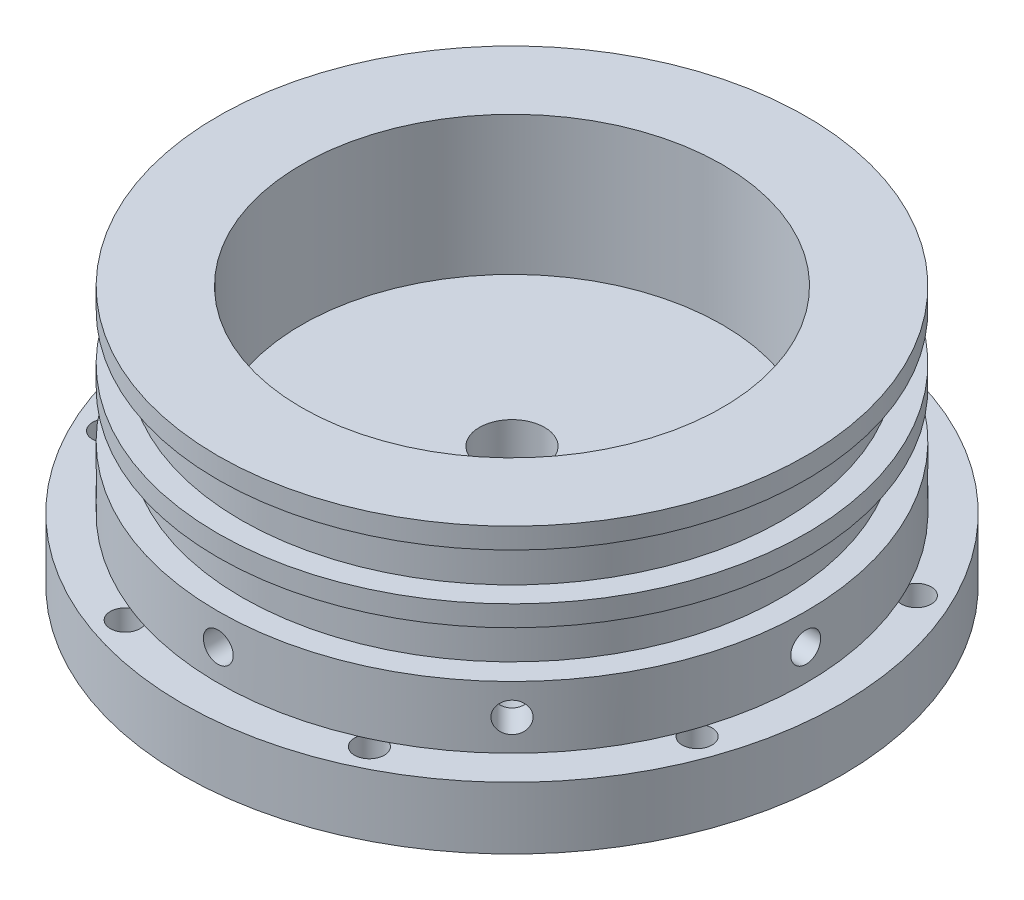
from build123d import *

# Parameters (mm, degrees)
SKETCH1_R                        = 45.085
BOSS_EXTRUDE1_DEPTH              = 9.525
SKETCH2_R                        = 41.402
BOSS_EXTRUDE2_DEPTH              = 7.1374
SKETCH3_R                        = 45.085
BOSS_EXTRUDE3_DEPTH              = 3.175
SKETCH4_R                        = 41.529
BOSS_EXTRUDE4_DEPTH              = 7.1374
SKETCH5_R                        = 45.085
BOSS_EXTRUDE5_DEPTH              = 3.175
CIRPATTERN1_COUNT                = 8
M10X1_0_TAPPED_HOLE1_D           = 9
M10X1_0_TAPPED_HOLE1_DEPTH       = 25
M10X1_0_TAPPED_HOLE1_CBORE_D     = 10
M10X1_0_TAPPED_HOLE1_CBORE_DEPTH = 20
M10X1_0_TAPPED_HOLE1_TIP         = 2.703872786
SKETCH9_R                        = 32.259
CUT_EXTRUDE1_DEPTH               = 21.2598
SKETCH11_R                       = 50.546
BOSS_EXTRUDE6_DEPTH              = 9.525
SKETCH12_R                       = 28.575
CUT_EXTRUDE2_DEPTH               = 9.525
F_15_0_18_DIAMETER_HOLE1_D       = 4.572
F_15_0_18_DIAMETER_HOLE1_DEPTH   = 9.525
CIRPATTERN2_COUNT                = 8


with BuildPart() as part:
    # Sketch1 → Boss-Extrude1 (new body)
    with BuildSketch(Plane(origin=(0, 0, 0), x_dir=(1, 0, 0), z_dir=(0, 1, 0))):
        with Locations(Location((0, 0, 0), (0, 0, 90))):
            Circle(SKETCH1_R)
    extrude(amount=BOSS_EXTRUDE1_DEPTH)

    # Sketch2 → Boss-Extrude2 (add)
    with BuildSketch(Plane(origin=(0, 9.525, 0), x_dir=(1, 0, 0), z_dir=(0, 1, 0))):
        with Locations(Location((0, 0, 0), (0, 0, 270))):
            Circle(SKETCH2_R)
    extrude(amount=BOSS_EXTRUDE2_DEPTH)

    # Sketch3 → Boss-Extrude3 (add)
    with BuildSketch(Plane(origin=(0, 16.6624, 0), x_dir=(1, 0, 0), z_dir=(0, 1, 0))):
        with Locations(Location((0, 0, 0), (0, 0, 90))):
            Circle(SKETCH3_R)
    extrude(amount=BOSS_EXTRUDE3_DEPTH)

    # Sketch4 → Boss-Extrude4 (add)
    with BuildSketch(Plane(origin=(0, 19.8374, 0), x_dir=(1, 0, 0), z_dir=(0, 1, 0))):
        with Locations(Location((0, 0, 0), (0, 0, 270))):
            Circle(SKETCH4_R)
    extrude(amount=BOSS_EXTRUDE4_DEPTH)

    # Sketch5 → Boss-Extrude5 (add)
    with BuildSketch(Plane(origin=(0, 26.9748, 0), x_dir=(1, 0, 0), z_dir=(0, 1, 0))):
        with Locations(Location((0, 0, 0), (0, 0, 90))):
            Circle(SKETCH5_R)
    extrude(amount=BOSS_EXTRUDE5_DEPTH)

    # Sketch6 → #15 (0.18) Diameter Hole2 (revolve, cut)
    with BuildSketch(Plane(origin=(-45.085, 4.7625, 0), x_dir=(0, 0, 1), z_dir=(0, 1, 0))):
        Polygon((0, 0), (0, 6.373567375), (2.286, 5), (2.286, 0), align=None)
    f_15_0_18_diameter_hole2 = revolve(axis=Axis((-51.435, 4.7625, 0), (1, 0, 0)), mode=Mode.SUBTRACT)

    # CirPattern1: #15 (0.18) Diameter Hole2 ×8 about axis
    cirpattern1_axis = Axis((0, 9.525, 0), (0, -1, 0))
    for i in range(1, CIRPATTERN1_COUNT):
        add(f_15_0_18_diameter_hole2.rotate(cirpattern1_axis, i * 360 / CIRPATTERN1_COUNT), mode=Mode.SUBTRACT)

    # M10x1.0 Tapped Hole1
    with Locations(Plane(origin=(0, 0, 0), x_dir=(-1, 0, 0), z_dir=(0, -1, 0))):
        with Locations((0, 0)):
            CounterBoreHole(M10X1_0_TAPPED_HOLE1_D / 2, M10X1_0_TAPPED_HOLE1_CBORE_D / 2, M10X1_0_TAPPED_HOLE1_CBORE_DEPTH, depth=M10X1_0_TAPPED_HOLE1_DEPTH)
            with Locations((0, 0, -(M10X1_0_TAPPED_HOLE1_DEPTH + M10X1_0_TAPPED_HOLE1_TIP / 2))):  # 118° drill point
                Cone(0, M10X1_0_TAPPED_HOLE1_D / 2, M10X1_0_TAPPED_HOLE1_TIP, mode=Mode.SUBTRACT)

    # Sketch9 → Cut-Extrude1 (cut)
    with BuildSketch(Plane(origin=(0, 30.1498, 0), x_dir=(1, 0, 0), z_dir=(0, 1, 0))):
        with Locations(Location((0, 0, 0), (0, 0, 270))):
            Circle(SKETCH9_R)
    extrude(amount=-CUT_EXTRUDE1_DEPTH, mode=Mode.SUBTRACT)

    # Sketch11 → Boss-Extrude6 (add)
    with BuildSketch(Plane(origin=(0, 0, 0), x_dir=(-1, 0, 0), z_dir=(0, -1, 0))):
        with Locations(Location((0, 0, 0), (0, 0, 270))):
            Circle(SKETCH11_R)
    extrude(amount=BOSS_EXTRUDE6_DEPTH)

    # Sketch12 → Cut-Extrude2 (cut)
    with BuildSketch(Plane.XZ.offset(9.525)):
        with Locations(Location((0, 0, 0), (0, 0, 270))):
            Circle(SKETCH12_R)
    extrude(amount=-CUT_EXTRUDE2_DEPTH, mode=Mode.SUBTRACT)

    # #15 (0.18) Diameter Hole1
    with Locations(Plane(origin=(15.459601618, -9.525, -43.838083818), x_dir=(0, 0, -1), z_dir=(0, -1, 0))):
        with Locations((0, 0)):
            f_15_0_18_diameter_hole1 = Hole(F_15_0_18_DIAMETER_HOLE1_D / 2, depth=F_15_0_18_DIAMETER_HOLE1_DEPTH)

    # CirPattern2: #15 (0.18) Diameter Hole1 ×8 about axis
    cirpattern2_axis = Axis((0, 0, 0), (0, 1, 0))
    for i in range(1, CIRPATTERN2_COUNT):
        add(f_15_0_18_diameter_hole1.rotate(cirpattern2_axis, i * 360 / CIRPATTERN2_COUNT), mode=Mode.SUBTRACT)


solid = part.part
